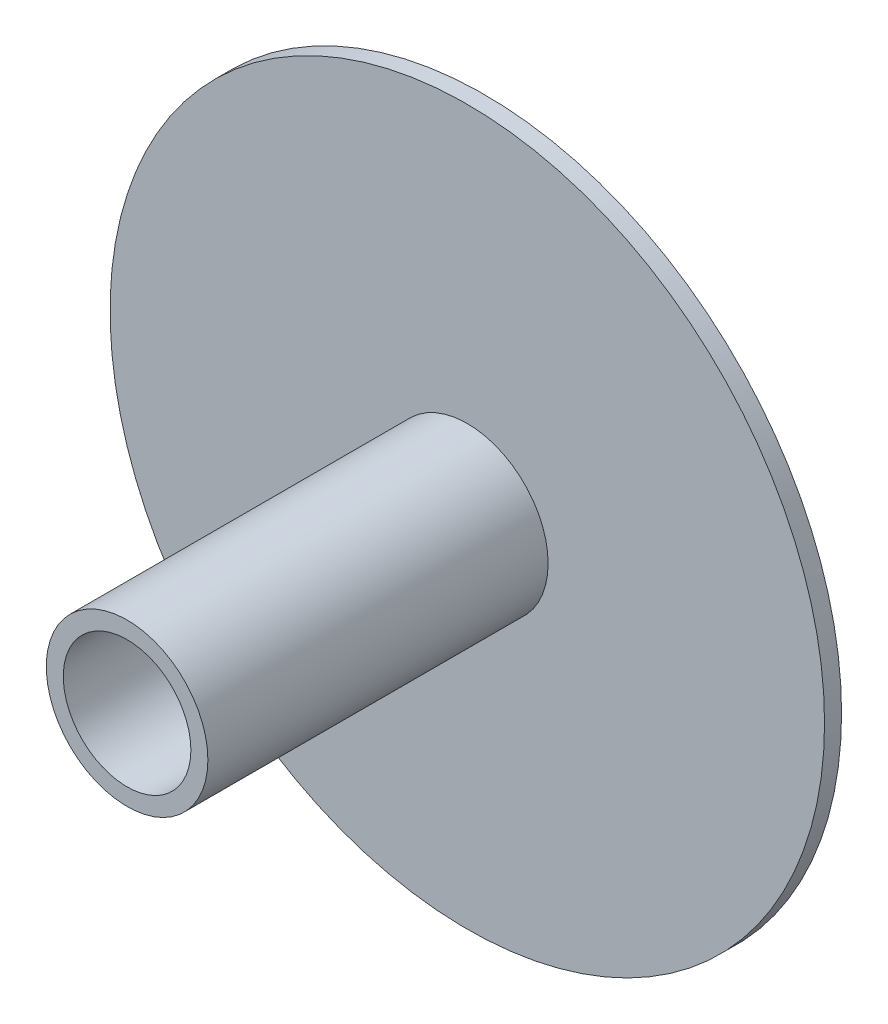
from build123d import *

# Parameters (mm, degrees)
SKETCH1_R               = 21
BOSS_EXTRUDE1_DEPTH     = 1
SKETCH2_R               = 4.75
BOSS_EXTRUDE2_DEPTH     = 20
CUT_EXTRUDE1_DEPTH      = 37.373066959
CUT_EXTRUDE1_DEPTH_BACK = 37.373066959
SKETCH3_R               = 3.75


with BuildPart() as part:
    # Sketch1 → Boss-Extrude1 (new body)
    with BuildSketch(Plane.XY):
        Circle(SKETCH1_R)
    extrude(amount=BOSS_EXTRUDE1_DEPTH)

    # Sketch2 → Boss-Extrude2 (add)
    with BuildSketch(Plane.XY.offset(1)):
        Circle(SKETCH2_R)
    extrude(amount=BOSS_EXTRUDE2_DEPTH)

    # Sketch3 → Cut-Extrude1 (cut, two sides: drawn at the far end of the back side and taken through both)
    with BuildSketch(Plane.XY.offset(21).offset(-CUT_EXTRUDE1_DEPTH_BACK)):
        Circle(SKETCH3_R)
    extrude(amount=CUT_EXTRUDE1_DEPTH + CUT_EXTRUDE1_DEPTH_BACK, mode=Mode.SUBTRACT)


solid = part.part
